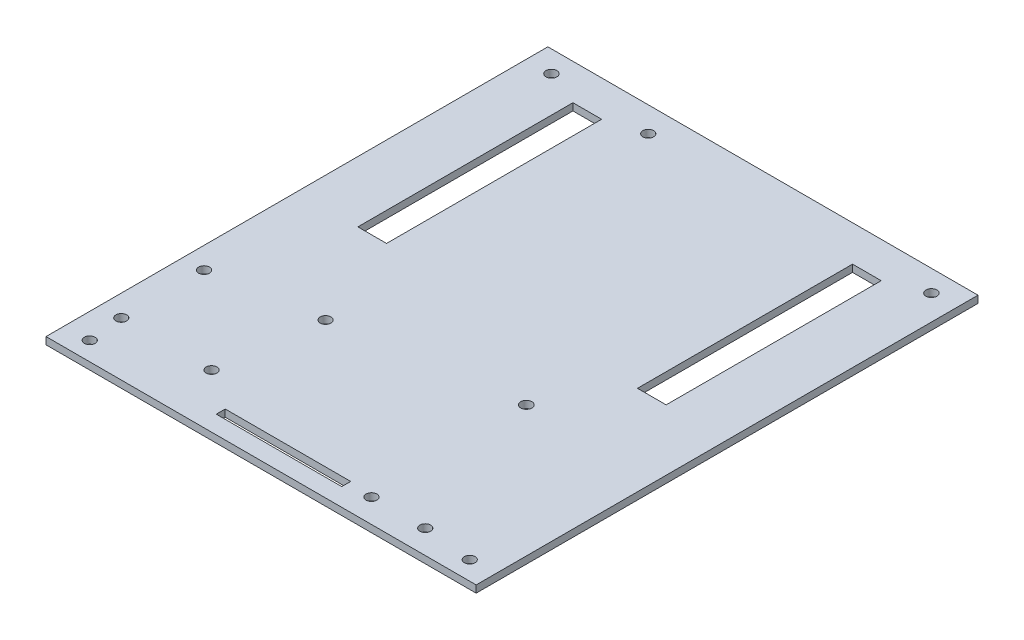
from build123d import *

# Parameters (mm, degrees)
SKETCH1_W           = 120
SKETCH1_H           = 140
BOSS_EXTRUDE1_DEPTH = 2
SKETCH2_R           = 1.525
SKETCH2_R_2         = 1.5
CUT_EXTRUDE1_DEPTH  = 2
SKETCH4_R           = 1.5
SKETCH4_R_2         = 1.55
SKETCH4_W           = 8
SKETCH4_H           = 60
CUT_EXTRUDE2_DEPTH  = 93.217135067
SKETCH5_R           = 1.5
SKETCH5_W           = 35
SKETCH5_H           = 2.5
CUT_EXTRUDE3_DEPTH  = 93.217135067


with BuildPart() as part:
    # Sketch1 → Boss-Extrude1 (new body)
    with BuildSketch(Plane(origin=(0, 0, 0), x_dir=(1, 0, 0), z_dir=(0, 1, 0))):
        Rectangle(SKETCH1_W, SKETCH1_H)
    extrude(amount=BOSS_EXTRUDE1_DEPTH)

    # Sketch2 → Cut-Extrude1 (cut)
    with BuildSketch(Plane(origin=(0, 2, 0), x_dir=(1, 0, 0), z_dir=(0, 1, 0))):
        with Locations(Location((-53, 64, 0), (0, 0, 270))):
            Circle(SKETCH2_R)
        with Locations(Location((-53, -64.8, 0), (0, 0, 270))):
            Circle(SKETCH2_R_2)
        with Locations(Location((53, 64, 0), (0, 0, 90))):
            Circle(SKETCH2_R)
        with Locations(Location((53, -64.8, 0), (0, 0, 90))):
            Circle(SKETCH2_R_2)
    extrude(amount=-CUT_EXTRUDE1_DEPTH, mode=Mode.SUBTRACT)

    # Sketch4 → Cut-Extrude2 (cut, through all)
    with BuildSketch(Plane(origin=(0, 2, 0), x_dir=(1, 0, 0), z_dir=(0, 1, 0))):
        with Locations(Location((-25, 63, 0), (0, 0, 270))):
            Circle(SKETCH4_R)
        with Locations(Location((-25, -27, 0), (0, 0, 270))):
            Circle(SKETCH4_R)
        with Locations(Location((23.5, -19.5, 0), (0, 0, 270))):
            Circle(SKETCH4_R_2)
        with Locations((-39, 30)):
            Rectangle(SKETCH4_W, SKETCH4_H)
        with Locations((39, 30)):
            Rectangle(SKETCH4_W, SKETCH4_H)
    extrude(amount=-CUT_EXTRUDE2_DEPTH, mode=Mode.SUBTRACT)

    # Sketch5 → Cut-Extrude3 (cut, through all)
    with BuildSketch(Plane(origin=(0, 2, 0), x_dir=(1, 0, 0), z_dir=(0, 1, 0))):
        with Locations(Location((-54, -55, 0), (0, 0, 270))):
            Circle(SKETCH5_R)
        with Locations(Location((-28.82, -55, 0), (0, 0, 270))):
            Circle(SKETCH5_R)
        with Locations(Location((-54, -31.9, 0), (0, 0, 270))):
            Circle(SKETCH5_R)
        with Locations(Location((24.183561374, -63.38263981, 0), (0, 0, 270))):
            Circle(SKETCH5_R)
        with Locations(Location((39.183561374, -63.38263981, 0), (0, 0, 270))):
            Circle(SKETCH5_R)
        with Locations((0, -63.75)):
            Rectangle(SKETCH5_W, SKETCH5_H)
    extrude(amount=-CUT_EXTRUDE3_DEPTH, mode=Mode.SUBTRACT)


solid = part.part
